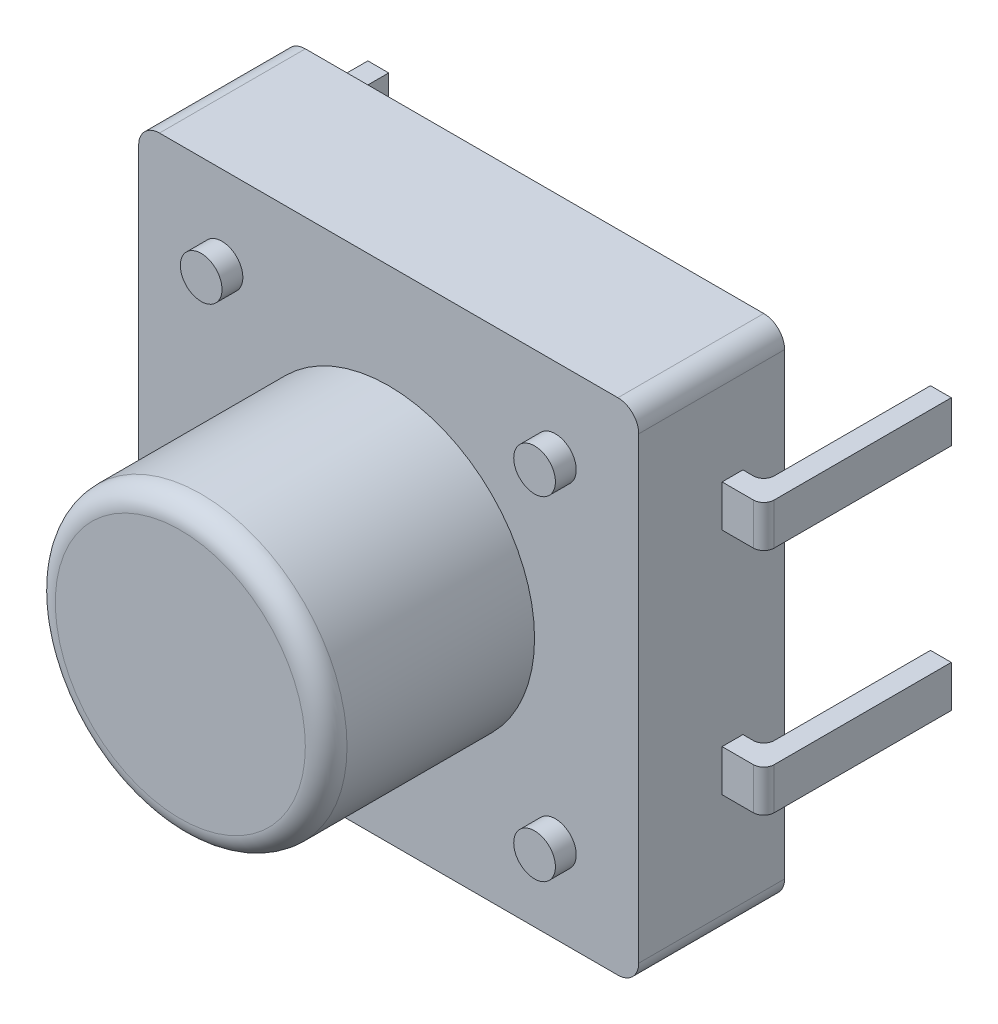
from build123d import *

# Parameters (mm, degrees)
Y_KSEKLIK_EKSTR_ZYON1_DEPTH = 3.5
IZIM2_R                     = 3.5
IZIM2_R_2                   = 0.5
Y_KSEKLIK_EKSTR_ZYON2_DEPTH = 0.5
IZIM3_R                     = 3.5
Y_KSEKLIK_EKSTR_ZYON3_DEPTH = 4.5
Y_KSEKLIK_EKSTR_ZYON4_DEPTH = 1
Y_KSEKLIK_EKSTR_ZYON5_DEPTH = 1
RADYUS1_R                   = 0.5


with BuildPart() as part:
    # Çizim1 → Yükseklik-Ekstrüzyon1 (new body)
    with BuildSketch(Plane.XY):
        with BuildLine():
            Line((0.5, 0), (11.5, 0))
            ThreePointArc((11.5, 0), (11.853553391, 0.146446609), (12, 0.5))
            Line((12, 0.5), (12, 11.5))
            ThreePointArc((12, 11.5), (11.853553391, 11.853553391), (11.5, 12))
            Line((11.5, 12), (0.5, 12))
            ThreePointArc((0.5, 12), (0.146446609, 11.853553391), (0, 11.5))
            Line((0, 11.5), (0, 0.5))
            ThreePointArc((0, 0.5), (0.146446609, 0.146446609), (0.5, 0))
        make_face()
    extrude(amount=Y_KSEKLIK_EKSTR_ZYON1_DEPTH)

    # Çizim2 → Yükseklik-Ekstrüzyon2 (add)
    with BuildSketch(Plane.XY.offset(3.5)):
        with Locations(Location((6, 6, 0), (0, 0, 180))):
            Circle(IZIM2_R)
        with Locations(Location((10, 10, 0), (0, 0, 180))):
            Circle(IZIM2_R_2)
        with Locations(Location((2, 10, 0), (0, 0, 180))):
            Circle(IZIM2_R_2)
        with Locations(Location((2, 2, 0), (0, 0, 180))):
            Circle(IZIM2_R_2)
        with Locations(Location((10, 2, 0), (0, 0, 180))):
            Circle(IZIM2_R_2)
    extrude(amount=Y_KSEKLIK_EKSTR_ZYON2_DEPTH)

    # Çizim3 → Yükseklik-Ekstrüzyon3 (add)
    with BuildSketch(Plane.XY.offset(4)):
        with Locations(Location((6, 6, 0), (0, 0, 180))):
            Circle(IZIM3_R)
    extrude(amount=Y_KSEKLIK_EKSTR_ZYON3_DEPTH)

    # Çizim4 → Yükseklik-Ekstrüzyon4 (add)
    with BuildSketch(Plane(origin=(0, 3, 0), x_dir=(-1, 0, 0), z_dir=(0, -1, 0))):
        with BuildLine():
            Line((0, -1), (0.25, -1))
            ThreePointArc((0.25, -1), (0.426776695, -0.926776695), (0.5, -0.75))
            Line((0.5, -0.75), (0.5, 3))
            Line((0.5, 3), (1, 3))
            Line((1, 3), (1, -1.25))
            ThreePointArc((1, -1.25), (0.926776695, -1.426776695), (0.75, -1.5))
            Line((0.75, -1.5), (0, -1.5))
            Line((0, -1.5), (0, -1))
        make_face()
        with BuildLine():
            Line((-12, -1.5), (-12, -1))
            Line((-12, -1), (-12.25, -1))
            ThreePointArc((-12.25, -1), (-12.426776695, -0.926776695), (-12.5, -0.75))
            Line((-12.5, -0.75), (-12.5, 3))
            Line((-12.5, 3), (-13, 3))
            Line((-13, 3), (-13, -1.25))
            ThreePointArc((-13, -1.25), (-12.926776695, -1.426776695), (-12.75, -1.5))
            Line((-12.75, -1.5), (-12, -1.5))
        make_face()
    extrude(amount=-Y_KSEKLIK_EKSTR_ZYON4_DEPTH)

    # Çizim6 → Yükseklik-Ekstrüzyon5 (add)
    with BuildSketch(Plane(origin=(0, 8.5, 0), x_dir=(1, 0, 0), z_dir=(0, 1, 0))):
        with BuildLine():
            Line((13, -1.25), (13, 3))
            Line((13, 3), (12.5, 3))
            Line((12.5, 3), (12.5, -0.75))
            ThreePointArc((12.5, -0.75), (12.426776695, -0.926776695), (12.25, -1))
            Line((12.25, -1), (12, -1))
            Line((12, -1), (12, -1.5))
            Line((12, -1.5), (12.75, -1.5))
            ThreePointArc((12.75, -1.5), (12.926776695, -1.426776695), (13, -1.25))
        make_face()
        with BuildLine():
            Line((0, -1.5), (0, -1))
            Line((0, -1), (-0.25, -1))
            ThreePointArc((-0.25, -1), (-0.426776695, -0.926776695), (-0.5, -0.75))
            Line((-0.5, -0.75), (-0.5, 3))
            Line((-0.5, 3), (-1, 3))
            Line((-1, 3), (-1, -1.25))
            ThreePointArc((-1, -1.25), (-0.926776695, -1.426776695), (-0.75, -1.5))
            Line((-0.75, -1.5), (0, -1.5))
        make_face()
    extrude(amount=Y_KSEKLIK_EKSTR_ZYON5_DEPTH)

    # Radyus1
    radyus1_edges = [part.edges().sort_by_distance(p)[0] for p in [
        (9.5, 6, 8.5),
    ]]
    fillet(radyus1_edges, radius=RADYUS1_R)


solid = part.part
